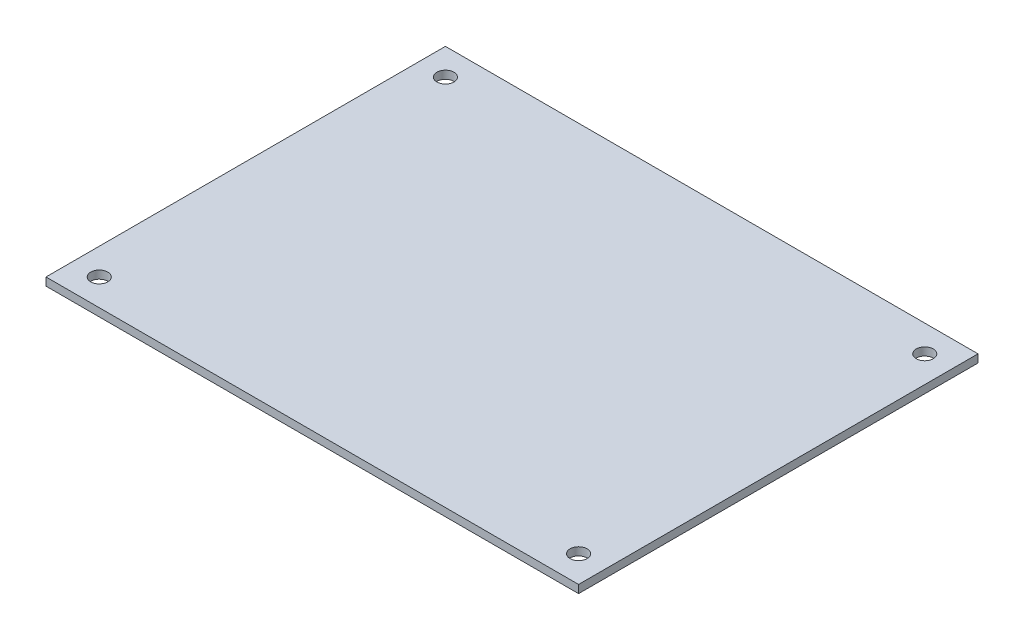
from build123d import *

# Parameters (mm, degrees)
SKETCH1_W           = 100
SKETCH1_H           = 75
SKETCH1_R           = 1.6
BOSS_EXTRUDE1_DEPTH = 1.5


with BuildPart() as part:
    # Sketch1 → Boss-Extrude1 (new body)
    with BuildSketch(Plane(origin=(0, 0, 0), x_dir=(1, 0, 0), z_dir=(0, 1, 0))):
        Rectangle(SKETCH1_W, SKETCH1_H)
        with Locations(Location((-45, 32.5, 0), (0, 0, 270))):
            Circle(SKETCH1_R, mode=Mode.SUBTRACT)
        with Locations(Location((45, 32.5, 0), (0, 0, 90))):
            Circle(SKETCH1_R, mode=Mode.SUBTRACT)
        with Locations(Location((45, -32.5, 0), (0, 0, 270))):
            Circle(SKETCH1_R, mode=Mode.SUBTRACT)
        with Locations(Location((-45, -32.5, 0), (0, 0, 90))):
            Circle(SKETCH1_R, mode=Mode.SUBTRACT)
    extrude(amount=BOSS_EXTRUDE1_DEPTH)


solid = part.part
